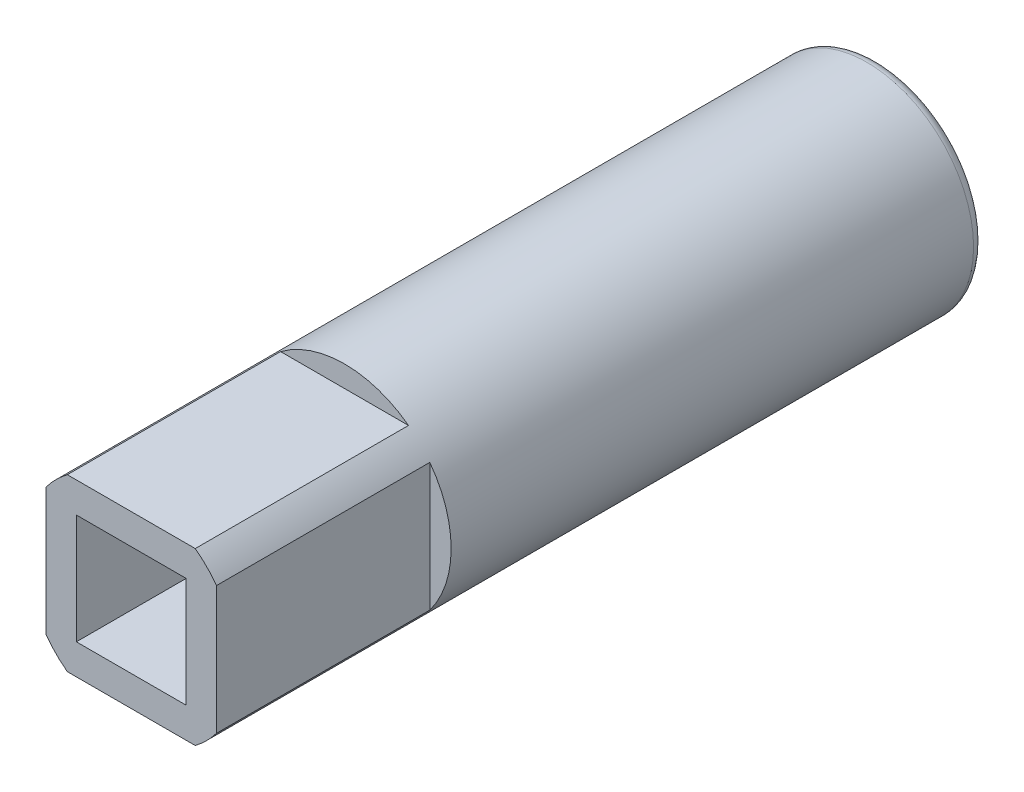
from build123d import *

# Parameters (mm, degrees)
SKETCH1_R           = 5
BOSS_EXTRUDE1_DEPTH = 25
CUT_EXTRUDE1_DEPTH  = 8
BOSS_EXTRUDE2_DEPTH = 10
SKETCH4_W           = 5.15
SKETCH4_H           = 5.15
CUT_EXTRUDE2_DEPTH  = 10
FILLET1_R           = 0.5


with BuildPart() as part:
    # Sketch1 → Boss-Extrude1 (new body)
    with BuildSketch(Plane.XY):
        Circle(SKETCH1_R)
    extrude(amount=BOSS_EXTRUDE1_DEPTH)

    # Sketch2 → Cut-Extrude1 (cut)
    with BuildSketch(Plane(origin=(0, 0, 0), x_dir=(-1, 0, 0), z_dir=(0, 0, -1))):
        with BuildLine():
            Line((-2.221320345, -1.785563195), (2.221320345, -1.785563195))
            ThreePointArc((2.221320345, -1.785563195), (2.849942511, 0.018102015), (2.198459265, 1.813636364))
            Line((2.198459265, 1.813636364), (-2.198459265, 1.813636364))
            ThreePointArc((-2.198459265, 1.813636364), (-2.849942511, 0.018102015), (-2.221320345, -1.785563195))
        make_face()
    extrude(amount=-CUT_EXTRUDE1_DEPTH, mode=Mode.SUBTRACT)

    # Sketch3 → Boss-Extrude2 (add)
    with BuildSketch(Plane.XY.offset(25)):
        with BuildLine():
            ThreePointArc((-4, -3), (-3.535533906, -3.535533906), (-3, -4))
            Line((-3, -4), (3, -4))
            ThreePointArc((3, -4), (3.535533906, -3.535533906), (4, -3))
            Line((4, -3), (4, 3))
            ThreePointArc((4, 3), (3.535533906, 3.535533906), (3, 4))
            Line((3, 4), (-3, 4))
            ThreePointArc((-3, 4), (-3.535533906, 3.535533906), (-4, 3))
            Line((-4, 3), (-4, -3))
        make_face()
    extrude(amount=BOSS_EXTRUDE2_DEPTH)

    # Sketch4 → Cut-Extrude2 (cut)
    with BuildSketch(Plane.XY.offset(35)):
        Rectangle(SKETCH4_W, SKETCH4_H)
    extrude(amount=-CUT_EXTRUDE2_DEPTH, mode=Mode.SUBTRACT)

    # Fillet1
    fillet1_edges = [part.edges().sort_by_distance(p)[0] for p in [
        (-5, 0, 0),
    ]]
    fillet(fillet1_edges, radius=FILLET1_R)


solid = part.part
